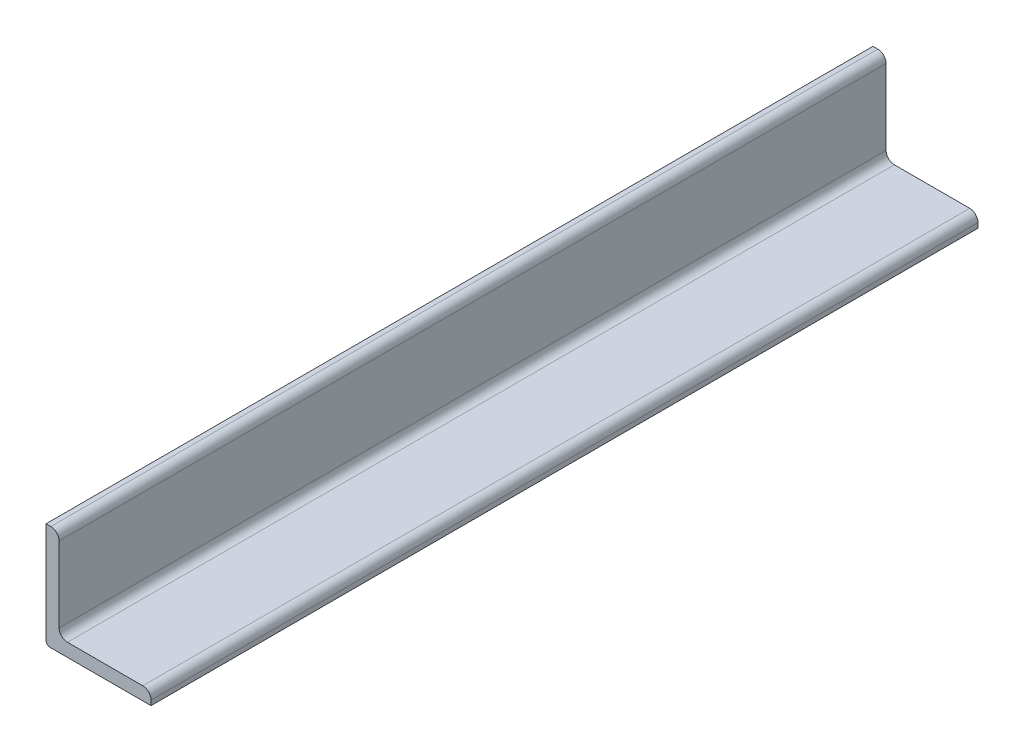
from build123d import *

# Parameters (mm, degrees)
BOSS_EXTRUDE1_DEPTH = 100
FILLET1_R           = 0.5
FILLET2_R           = 1


with BuildPart() as part:
    # Sketch1 → Boss-Extrude1 (new body)
    with BuildSketch(Plane.XY):
        Polygon((0, 0), (0, 12.7), (1.5875, 12.7), (1.5875, 1.5875), (12.7, 1.5875), (12.7, 0), align=None)
    extrude(amount=BOSS_EXTRUDE1_DEPTH)

    # Fillet1
    fillet1_edges = [part.edges().sort_by_distance(p)[0] for p in [
        (0, 0, 50),
    ]]
    fillet(fillet1_edges, radius=FILLET1_R)

    # Fillet2
    fillet2_edges = [part.edges().sort_by_distance(p)[0] for p in [
        (1.5875, 12.7, 50),
        (1.5875, 1.5875, 50),
        (12.7, 1.5875, 50),
    ]]
    fillet(fillet2_edges, radius=FILLET2_R)


solid = part.part
